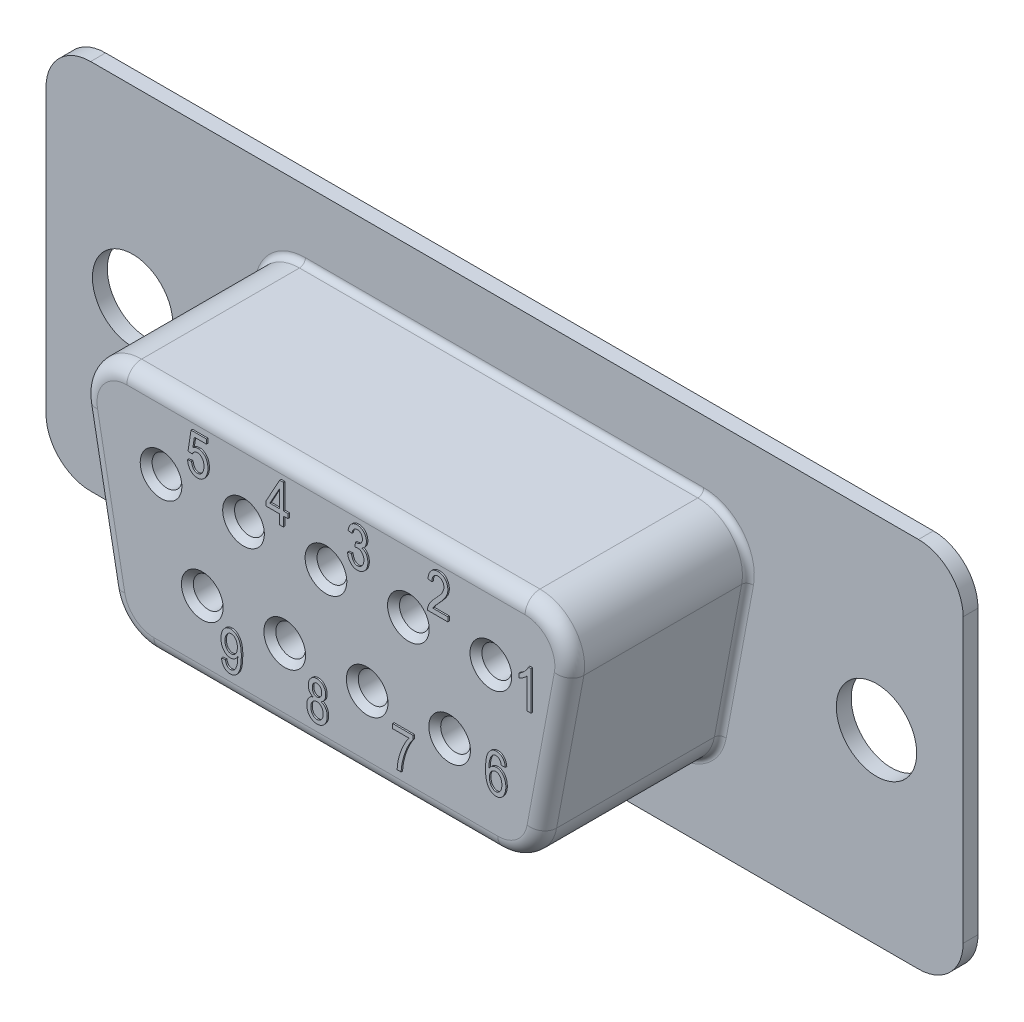
from build123d import *

# Parameters (mm, degrees)
RESSALTO_EXTRUS_O1_DEPTH            = 0.5
ESBO_O3_R                           = 1.35
CORTE_EXTRUS_O1_DEPTH               = 17.632093224
RESSALTO_EXTRUS_O2_DEPTH            = 6
ESBO_O5_R                           = 0.5
CORTE_EXTRUS_O2_DEPTH               = 18.850112745
CHANFRO1_SIZE                       = 0.2
PADR_O_LINEAR1_COUNT                = 3
PADR_O_LINEAR1_PITCH                = 2.77
CHANFRO1_OF_PADR_O_LINEAR1_SIZE     = 0.2
PADR_O_LINEAR1_COL_COUNT            = 3
PADR_O_LINEAR1_COL_PITCH            = 2.77
CHANFRO1_OF_PADR_O_LINEAR1_COL_SIZE = 0.2
ESBO_O6_R                           = 0.5
CORTE_EXTRUS_O3_DEPTH               = 18.850112745
CHANFRO2_SIZE                       = 0.2
PADR_O_LINEAR2_COUNT                = 3
PADR_O_LINEAR2_PITCH                = 2.77
CHANFRO2_OF_PADR_O_LINEAR2_SIZE     = 0.2
PADR_O_LINEAR2_COL_COUNT            = 2
PADR_O_LINEAR2_COL_PITCH            = 2.77
CHANFRO2_OF_PADR_O_LINEAR2_COL_SIZE = 0.2
FILETE1_R                           = 0.5
FILETE2_R                           = 0.2
RESSALTO_EXTRUS_O3_DEPTH            = 0.05
RESSALTO_EXTRUS_O4_START            = -5
ESBO_O8_R                           = 0.5
ESBO_O8_R_2                         = 0.45
RESSALTO_EXTRUS_O4_DEPTH            = 5
PADR_O_LINEAR3_COUNT                = 5
PADR_O_LINEAR3_PITCH                = 2.77
RESSALTO_EXTRUS_O5_START            = -5
ESBO_O9_R                           = 0.5
ESBO_O9_R_2                         = 0.45
RESSALTO_EXTRUS_O5_DEPTH            = 5
PADR_O_LINEAR4_COUNT                = 4
PADR_O_LINEAR4_PITCH                = 2.77


with BuildPart() as part:
    # Esboço2 → Ressalto-extrusão1 (new body)
    with BuildSketch(Plane.XY):
        with BuildLine():
            Line((-13.905, 6.25), (13.905, 6.25))
            ThreePointArc((13.905, 6.25), (14.965660172, 5.810660172), (15.405, 4.75))
            Line((15.405, 4.75), (15.405, -4.75))
            ThreePointArc((15.405, -4.75), (14.965660172, -5.810660172), (13.905, -6.25))
            Line((13.905, -6.25), (-13.905, -6.25))
            ThreePointArc((-13.905, -6.25), (-14.965660172, -5.810660172), (-15.405, -4.75))
            Line((-15.405, -4.75), (-15.405, 4.75))
            ThreePointArc((-15.405, 4.75), (-14.965660172, 5.810660172), (-13.905, 6.25))
        make_face()
    extrude(amount=RESSALTO_EXTRUS_O1_DEPTH)

    # Esboço3 → Corte-extrusão1 (cut, through all)
    with BuildSketch(Plane.XY.offset(0.5)):
        with Locations((12.495, 0)):
            Circle(ESBO_O3_R)
    corte_extrus_o1 = extrude(amount=-CORTE_EXTRUS_O1_DEPTH, mode=Mode.SUBTRACT)

    # Espelhar1: Corte-extrusão1 across plane
    add(corte_extrus_o1.mirror(Plane(origin=(0, 0, 0), x_dir=(0, 0, 1), z_dir=(1, 0, 0))), mode=Mode.SUBTRACT)

    # Esboço4 → Ressalto-extrusão2 (add)
    with BuildSketch(Plane.XY.offset(0.5)):
        with BuildLine():
            Line((-6.690487724, 3.95), (6.690487724, 3.95))
            ThreePointArc((6.690487724, 3.95), (7.844397143, 3.408380431), (8.165, 2.174657401))
            Line((8.165, 2.174657401), (7.25, -2.725342599))
            ThreePointArc((7.25, -2.725342599), (6.733868155, -3.60390942), (5.775487724, -3.95))
            Line((5.775487724, -3.95), (-5.775487724, -3.95))
            ThreePointArc((-5.775487724, -3.95), (-6.733868155, -3.60390942), (-7.25, -2.725342599))
            Line((-7.25, -2.725342599), (-8.165, 2.174657401))
            ThreePointArc((-8.165, 2.174657401), (-7.844397143, 3.408380431), (-6.690487724, 3.95))
        make_face()
    extrude(amount=RESSALTO_EXTRUS_O2_DEPTH)

    # Esboço5 → Corte-extrusão2 (cut, through all)
    with BuildSketch(Plane.XY.offset(6.5)):
        with Locations((0, 1.42)):
            Circle(ESBO_O5_R)
    corte_extrus_o2 = extrude(amount=-CORTE_EXTRUS_O2_DEPTH, mode=Mode.SUBTRACT)

    # Chanfro1
    chanfro1_edges = [part.edges().sort_by_distance(p)[0] for p in [
        (-0.5, 1.42, 6.5),
    ]]
    chamfer(chanfro1_edges, length=CHANFRO1_SIZE)

    # Padrão linear1: Corte-extrusão2 ×3
    with Locations(*[(i * PADR_O_LINEAR1_PITCH, 0, 0) for i in range(1, PADR_O_LINEAR1_COUNT)]):
        add(corte_extrus_o2, mode=Mode.SUBTRACT)

    # Chanfro1 of Padrão linear1
    chanfro1_of_padr_o_linear1_edges = [part.edges().sort_by_distance(p)[0] for p in [
        (2.27, 1.42, 6.5),
        (5.04, 1.42, 6.5),
    ]]
    chamfer(chanfro1_of_padr_o_linear1_edges, length=CHANFRO1_OF_PADR_O_LINEAR1_SIZE)

    # Padrão linear1 col: Corte-extrusão2 ×3
    with Locations(*[(-i * PADR_O_LINEAR1_COL_PITCH, 0, 0) for i in range(1, PADR_O_LINEAR1_COL_COUNT)]):
        add(corte_extrus_o2, mode=Mode.SUBTRACT)

    # Chanfro1 of Padrão linear1 col
    chanfro1_of_padr_o_linear1_col_edges = [part.edges().sort_by_distance(p)[0] for p in [
        (-3.27, 1.42, 6.5),
        (-6.04, 1.42, 6.5),
    ]]
    chamfer(chanfro1_of_padr_o_linear1_col_edges, length=CHANFRO1_OF_PADR_O_LINEAR1_COL_SIZE)

    # Esboço6 → Corte-extrusão3 (cut, through all)
    with BuildSketch(Plane.XY.offset(6.5)):
        with Locations((-1.385, -1.42)):
            Circle(ESBO_O6_R)
    corte_extrus_o3 = extrude(amount=-CORTE_EXTRUS_O3_DEPTH, mode=Mode.SUBTRACT)

    # Chanfro2
    chanfro2_edges = [part.edges().sort_by_distance(p)[0] for p in [
        (-1.885, -1.42, 6.5),
    ]]
    chamfer(chanfro2_edges, length=CHANFRO2_SIZE)

    # Padrão linear2: Corte-extrusão3 ×3
    with Locations(*[(i * PADR_O_LINEAR2_PITCH, 0, 0) for i in range(1, PADR_O_LINEAR2_COUNT)]):
        add(corte_extrus_o3, mode=Mode.SUBTRACT)

    # Chanfro2 of Padrão linear2
    chanfro2_of_padr_o_linear2_edges = [part.edges().sort_by_distance(p)[0] for p in [
        (0.885, -1.42, 6.5),
        (3.655, -1.42, 6.5),
    ]]
    chamfer(chanfro2_of_padr_o_linear2_edges, length=CHANFRO2_OF_PADR_O_LINEAR2_SIZE)

    # Padrão linear2 col: Corte-extrusão3 ×2
    with Locations(*[(-i * PADR_O_LINEAR2_COL_PITCH, 0, 0) for i in range(1, PADR_O_LINEAR2_COL_COUNT)]):
        add(corte_extrus_o3, mode=Mode.SUBTRACT)

    # Chanfro2 of Padrão linear2 col
    chanfro2_of_padr_o_linear2_col_edges = [part.edges().sort_by_distance(p)[0] for p in [
        (-4.655, -1.42, 6.5),
    ]]
    chamfer(chanfro2_of_padr_o_linear2_col_edges, length=CHANFRO2_OF_PADR_O_LINEAR2_COL_SIZE)

    # Filete1
    filete1_edges = [part.edges().sort_by_distance(p)[0] for p in [
        (-7.844397143, 3.408380431, 6.5),
        (-7.7075, -0.275342599, 6.5),
        (-6.733868155, -3.60390942, 6.5),
        (0, -3.95, 6.5),
        (6.733868155, -3.60390942, 6.5),
        (7.7075, -0.275342599, 6.5),
        (7.844397143, 3.408380431, 6.5),
        (0, 3.95, 6.5),
    ]]
    fillet(filete1_edges, radius=FILETE1_R)

    # Filete2
    filete2_edges = [part.edges().sort_by_distance(p)[0] for p in [
        (-7.844397143, 3.408380431, 0.5),
        (-7.7075, -0.275342599, 0.5),
        (-6.733868155, -3.60390942, 0.5),
        (0, -3.95, 0.5),
        (6.733868155, -3.60390942, 0.5),
        (7.7075, -0.275342599, 0.5),
        (7.844397143, 3.408380431, 0.5),
        (0, 3.95, 0.5),
    ]]
    fillet(filete2_edges, radius=FILETE2_R)

    # Esboço7 → Ressalto-extrusão3 (add)
    # profile 1 of 9: a face of its own
    with BuildSketch(Plane.XY.offset(6.5)):
        with BuildLine():
            Line((6.938677294, 0.736527866), (6.805258142, 0.736527866))
            Line((6.805258142, 0.736527866), (6.805258142, 1.753848904))
            add(Edge.make_bspline(
                [(6.805258142, 1.753848904), (6.797064384, 1.744417187), (6.780082831, 1.724869962), (6.750603725, 1.697071085), (6.717752518, 1.668404771), (6.681381871, 1.64058832), (6.644323076, 1.61394466), (6.607720629, 1.590511099), (6.572946374, 1.570122133), (6.549617757, 1.559039788), (6.538419837, 1.553720175)],
                knots=[0, 0, 0, 0, 0.892555828, 1.849821039, 2.893015883, 4.008277588, 5.121255548, 6.154629642, 7.114207698, 8, 8, 8, 8], degree=3))
            Line((6.538419837, 1.553720175), (6.538419837, 1.703816722))
            add(Edge.make_bspline(
                [(6.538419837, 1.703816722), (6.556415797, 1.714647376), (6.592253624, 1.736215944), (6.642467109, 1.773579669), (6.68990314, 1.813907667), (6.733143865, 1.857622485), (6.771861185, 1.902685919), (6.805093151, 1.947659281), (6.832341258, 1.992064737), (6.845707326, 2.022610567), (6.852163312, 2.037364603)],
                knots=[0, 0, 0, 0, 1.082272232, 2.155277244, 3.222407096, 4.289527553, 5.32168536, 6.282742408, 7.170542132, 8, 8, 8, 8], degree=3))
            Line((6.852163312, 2.037364603), (6.938677294, 2.037364603))
            Line((6.938677294, 2.037364603), (6.938677294, 0.736527866))
        make_face()
    # profile 2 of 9: a face of its own
    with BuildSketch(Plane.XY.offset(6.5)):
        with BuildLine():
            Line((-4.599397663, 2.345046989), (-4.465978511, 2.361724383))
            add(Edge.make_bspline(
                [(-4.465978511, 2.361724383), (-4.464624309, 2.351540908), (-4.461985206, 2.331695082), (-4.456107995, 2.303126078), (-4.449625478, 2.276356425), (-4.440970092, 2.251912016), (-4.432189377, 2.229007247), (-4.42133457, 2.208485286), (-4.409716077, 2.189739273), (-4.396513857, 2.17337997), (-4.382803581, 2.158660149), (-4.368199024, 2.1462059), (-4.353082481, 2.135600043), (-4.337549249, 2.126680761), (-4.321275291, 2.119826548), (-4.304444561, 2.115187268), (-4.287149309, 2.11220043), (-4.275416708, 2.111777053), (-4.269497962, 2.111563472)],
                knots=[0, 0, 0, 0, 1.411223046, 2.750228965, 4.006672634, 5.191927097, 6.311278306, 7.373684419, 8.377051755, 9.337097037, 10.257438676, 11.13782359, 11.969011532, 12.792190119, 13.594685164, 14.388253401, 15.186922146, 16, 16, 16, 16], degree=3))
            add(Edge.make_bspline(
                [(-4.269497962, 2.111563472), (-4.262096201, 2.111805465), (-4.247447958, 2.112284373), (-4.225921591, 2.116369531), (-4.205093381, 2.122817762), (-4.185283744, 2.132423484), (-4.166084997, 2.144193436), (-4.147680751, 2.158666069), (-4.130359039, 2.176001237), (-4.11366847, 2.195502661), (-4.098225284, 2.21720759), (-4.085326348, 2.241431486), (-4.074110169, 2.26731906), (-4.064576786, 2.295046103), (-4.057690079, 2.324847355), (-4.052854279, 2.356475897), (-4.049576802, 2.389973208), (-4.049224699, 2.41296445), (-4.04904366, 2.42478578)],
                knots=[0, 0, 0, 0, 0.833557162, 1.649627401, 2.46080936, 3.284070299, 4.12358479, 4.995082037, 5.915776015, 6.88098611, 7.885890802, 8.910954604, 9.967600199, 11.063514457, 12.210406555, 13.409466691, 14.668034258, 16, 16, 16, 16], degree=3))
            add(Edge.make_bspline(
                [(-4.04904366, 2.42478578), (-4.049250164, 2.435824021), (-4.049652511, 2.457330635), (-4.052587811, 2.488663661), (-4.057120229, 2.518141087), (-4.063872724, 2.545721246), (-4.072871161, 2.571247676), (-4.083104825, 2.595157916), (-4.095744297, 2.616995597), (-4.110368223, 2.636649254), (-4.126103416, 2.654431666), (-4.143282661, 2.669657238), (-4.16123582, 2.682696053), (-4.180146346, 2.693707032), (-4.200371771, 2.701545146), (-4.221319384, 2.70780144), (-4.243424628, 2.71108247), (-4.258457522, 2.71165712), (-4.266110367, 2.711949659)],
                knots=[0, 0, 0, 0, 1.312040837, 2.556345105, 3.737883698, 4.854849349, 5.925960309, 6.952388988, 7.9424386, 8.917239489, 9.860521384, 10.760061641, 11.639947922, 12.495504232, 13.352616949, 14.212152034, 15.089854369, 16, 16, 16, 16], degree=3))
            add(Edge.make_bspline(
                [(-4.266110367, 2.711949659), (-4.275351377, 2.711547954), (-4.293786255, 2.710746596), (-4.321009261, 2.704252522), (-4.347155414, 2.693381957), (-4.372166661, 2.67878422), (-4.3954362, 2.660565376), (-4.416127623, 2.638578091), (-4.434577904, 2.613517789), (-4.444329847, 2.594831467), (-4.449301117, 2.585305697)],
                knots=[0, 0, 0, 0, 0.943378558, 1.881944462, 2.841095037, 3.827409543, 4.832274565, 5.849176661, 6.903569879, 8, 8, 8, 8], degree=3))
            Line((-4.449301117, 2.585305697), (-4.582720269, 2.60432835))
            Line((-4.582720269, 2.60432835), (-4.482655905, 3.262303662))
            Line((-4.482655905, 3.262303662), (-3.965656689, 3.262303662))
            Line((-3.965656689, 3.262303662), (-3.965656689, 3.112207116))
            Line((-3.965656689, 3.112207116), (-4.370865248, 3.112207116))
            Line((-4.370865248, 3.112207116), (-4.41907334, 2.795076045))
            add(Edge.make_bspline(
                [(-4.41907334, 2.795076045), (-4.404043348, 2.802762508), (-4.374297774, 2.817974643), (-4.326968558, 2.833817079), (-4.278328857, 2.843593372), (-4.245396127, 2.844775014), (-4.228846814, 2.845368811)],
                knots=[0, 0, 0, 0, 1.017619267, 2.013951072, 3.001973272, 4, 4, 4, 4], degree=3))
            add(Edge.make_bspline(
                [(-4.228846814, 2.845368811), (-4.21848836, 2.845003556), (-4.197901291, 2.844277623), (-4.167638716, 2.838913791), (-4.138371929, 2.830327715), (-4.110237385, 2.817871236), (-4.083220341, 2.801930671), (-4.057118625, 2.782629977), (-4.032058573, 2.759933608), (-4.008574325, 2.733615569), (-3.986684963, 2.704663123), (-3.96757433, 2.67287478), (-3.95135498, 2.638679983), (-3.938484831, 2.601915229), (-3.927883028, 2.562951411), (-3.920723259, 2.521424165), (-3.916606837, 2.477507676), (-3.915957173, 2.447465504), (-3.915624507, 2.43208214)],
                knots=[0, 0, 0, 0, 0.861018809, 1.711245113, 2.547675859, 3.391805506, 4.262674834, 5.151129072, 6.086914488, 7.068866089, 8.080081396, 9.100796714, 10.1476286, 11.221399762, 12.335728169, 13.501851446, 14.720800604, 16, 16, 16, 16], degree=3))
            add(Edge.make_bspline(
                [(-3.915624507, 2.43208214), (-3.915941703, 2.416784694), (-3.916566631, 2.386646234), (-3.920998352, 2.342295284), (-3.928604776, 2.299636242), (-3.939039236, 2.258609576), (-3.952238919, 2.219141446), (-3.968774979, 2.181409215), (-3.988367974, 2.145450785), (-4.010585049, 2.111403677), (-4.03535252, 2.080332571), (-4.062306362, 2.05280439), (-4.091653745, 2.029835699), (-4.122914767, 2.010803886), (-4.156303566, 1.996105756), (-4.1917695, 1.985700529), (-4.229308484, 1.979272591), (-4.255052896, 1.978525632), (-4.268195041, 1.97814432)],
                knots=[0, 0, 0, 0, 1.144340564, 2.254537473, 3.330370625, 4.383172833, 5.418849903, 6.440219285, 7.460844228, 8.47914966, 9.47775429, 10.428908251, 11.354479858, 12.258284926, 13.160219244, 14.07516849, 15.0174017, 16, 16, 16, 16], degree=3))
            add(Edge.make_bspline(
                [(-4.268195041, 1.97814432), (-4.279153962, 1.978458156), (-4.300728257, 1.979075989), (-4.332442741, 1.983562612), (-4.362847645, 1.991121362), (-4.39196227, 2.001848836), (-4.419657457, 2.015803366), (-4.446197576, 2.032532718), (-4.471206063, 2.052516613), (-4.49497137, 2.075157792), (-4.516808253, 2.100581325), (-4.536124273, 2.128702732), (-4.553149541, 2.159009838), (-4.567498207, 2.191753048), (-4.579116762, 2.22678461), (-4.588514298, 2.264055175), (-4.595657498, 2.30366454), (-4.598131346, 2.33103603), (-4.599397663, 2.345046989)],
                knots=[0, 0, 0, 0, 0.958587677, 1.88712499, 2.795765124, 3.694982091, 4.595578744, 5.504218877, 6.434682167, 7.391400486, 8.372260331, 9.360890354, 10.371359061, 11.409147611, 12.483330096, 13.596558593, 14.769722824, 16, 16, 16, 16], degree=3))
        make_face()
    # profile 3 of 9: a face of its own
    with BuildSketch(Plane.XY.offset(6.5)):
        Polygon((-1.512412023, 1.994821714), (-1.512412023, 2.311692201), (-1.962701663, 2.311692201), (-1.962701663, 2.461788748), (-1.504855079, 3.295658451), (-1.378992871, 3.295658451), (-1.378992871, 2.461788748), (-1.228896324, 2.461788748), (-1.228896324, 2.311692201), (-1.378992871, 2.311692201), (-1.378992871, 1.994821714), align=None)
        Polygon((-1.512412023, 2.461788748), (-1.512412023, 3.042109944), (-1.8311066, 2.461788748), align=None, mode=Mode.SUBTRACT)
    # profile 4 of 9: a face of its own
    with BuildSketch(Plane.XY.offset(6.5)):
        with BuildLine():
            Line((0.774058702, 2.345046989), (0.907477854, 2.361724383))
            add(Edge.make_bspline(
                [(0.907477854, 2.361724383), (0.909198596, 2.351628042), (0.912551693, 2.331953969), (0.9191491, 2.30364214), (0.926349548, 2.277149626), (0.934695026, 2.252725828), (0.943791841, 2.230132181), (0.953879596, 2.209512746), (0.965158079, 2.190870977), (0.977349675, 2.174196066), (0.99049204, 2.159409052), (1.004525392, 2.146606792), (1.019581156, 2.135798445), (1.035515814, 2.126803596), (1.052581527, 2.120130839), (1.070442985, 2.115038197), (1.089362628, 2.112205754), (1.102299211, 2.111780677), (1.108909505, 2.111563472)],
                knots=[0, 0, 0, 0, 1.392235382, 2.712957193, 3.95076201, 5.123471921, 6.220028287, 7.260520794, 8.240826993, 9.178593426, 10.065213643, 10.926376853, 11.755607984, 12.580369742, 13.407158359, 14.241002189, 15.101193065, 16, 16, 16, 16], degree=3))
            add(Edge.make_bspline(
                [(1.108909505, 2.111563472), (1.116139472, 2.111701038), (1.130350097, 2.111971426), (1.151174798, 2.115999513), (1.171407144, 2.121498765), (1.190698265, 2.130064056), (1.209387855, 2.140588625), (1.227499321, 2.153286316), (1.244320922, 2.168983753), (1.260701946, 2.186239308), (1.275810381, 2.205395579), (1.28883742, 2.226318441), (1.299808744, 2.248701226), (1.309015197, 2.27227624), (1.315603479, 2.297426686), (1.321030669, 2.323651336), (1.323753038, 2.351504531), (1.324189158, 2.370492806), (1.324412706, 2.380225867)],
                knots=[0, 0, 0, 0, 0.904038564, 1.776903143, 2.648138989, 3.525264603, 4.411852617, 5.332561374, 6.2875971, 7.288147468, 8.311042921, 9.337403868, 10.368883854, 11.429611823, 12.501164111, 13.621320171, 14.780729868, 16, 16, 16, 16], degree=3))
            add(Edge.make_bspline(
                [(1.324412706, 2.380225867), (1.324176401, 2.389351747), (1.323716323, 2.407119542), (1.321185825, 2.433108954), (1.316549346, 2.457731376), (1.30962176, 2.480919553), (1.301418204, 2.503030666), (1.290947025, 2.523613279), (1.278590407, 2.542785195), (1.264610869, 2.560410343), (1.249176738, 2.576294768), (1.23289955, 2.590433238), (1.21551539, 2.602182753), (1.197462317, 2.612076058), (1.178248017, 2.619187463), (1.158432418, 2.624847956), (1.137586075, 2.627974289), (1.123424984, 2.628364013), (1.116205864, 2.628562688)],
                knots=[0, 0, 0, 0, 1.208507307, 2.352925112, 3.453685551, 4.520081629, 5.553915499, 6.572344605, 7.570902253, 8.569592363, 9.545641393, 10.499968035, 11.418701314, 12.319183888, 13.218416966, 14.125267075, 15.044288268, 16, 16, 16, 16], degree=3))
            add(Edge.make_bspline(
                [(1.116205864, 2.628562688), (1.109677921, 2.628357245), (1.095762141, 2.627919296), (1.073849766, 2.624131878), (1.049599603, 2.618808703), (1.032956569, 2.613585132), (1.024219613, 2.610842957)],
                knots=[0, 0, 0, 0, 0.832645691, 1.774971563, 2.831945141, 4, 4, 4, 4], degree=3))
            Line((1.024219613, 2.610842957), (1.040897007, 2.761981841))
            Line((1.040897007, 2.761981841), (1.060961997, 2.760157751))
            add(Edge.make_bspline(
                [(1.060961997, 2.760157751), (1.068705006, 2.760245565), (1.083814236, 2.76041692), (1.105911772, 2.76358348), (1.126991092, 2.767778739), (1.146838927, 2.774145838), (1.165696536, 2.781972731), (1.183270119, 2.791893556), (1.199880282, 2.803461533), (1.215230024, 2.81667722), (1.229009632, 2.831618113), (1.241319041, 2.847657419), (1.251493819, 2.865045826), (1.259948633, 2.883443274), (1.266431523, 2.90311566), (1.271162673, 2.92395963), (1.273677396, 2.946067207), (1.274142137, 2.961149415), (1.274380524, 2.968885761)],
                knots=[0, 0, 0, 0, 1.104467345, 2.155189185, 3.181695374, 4.170183668, 5.126157628, 6.092295424, 7.04536858, 8.012620263, 8.977961638, 9.942904556, 10.893715412, 11.848320646, 12.828840281, 13.845861792, 14.895045293, 16, 16, 16, 16], degree=3))
            add(Edge.make_bspline(
                [(1.274380524, 2.968885761), (1.273782541, 2.982743645), (1.272633324, 3.009376019), (1.263811774, 3.047308283), (1.248439823, 3.080884249), (1.227278381, 3.109590895), (1.201813304, 3.13272388), (1.173365796, 3.150059564), (1.14181664, 3.160330995), (1.119840841, 3.161595372), (1.10864892, 3.162239298)],
                knots=[0, 0, 0, 0, 1.168747258, 2.246123166, 3.262822778, 4.26410748, 5.234436762, 6.148309006, 7.056963545, 8, 8, 8, 8], degree=3))
            add(Edge.make_bspline(
                [(1.10864892, 3.162239298), (1.097019502, 3.161698581), (1.074396254, 3.160646698), (1.042046472, 3.150612184), (1.012284288, 3.135240455), (0.990588871, 3.116752142), (0.975214527, 3.099247652), (0.964366775, 3.084497262), (0.9547276, 3.068094993), (0.94655833, 3.049894387), (0.938695856, 3.030397897), (0.933135414, 3.008940398), (0.927581452, 2.986175845), (0.925321494, 2.970302145), (0.924155248, 2.962110569)],
                knots=[0, 0, 0, 0, 1.389180941, 2.702438466, 4.019316734, 5.377896697, 6.085434137, 6.807430375, 7.567469407, 8.358691296, 9.195188439, 10.081130764, 11.009773198, 12, 12, 12, 12], degree=3))
            Line((0.924155248, 2.962110569), (0.790736096, 2.978787963))
            add(Edge.make_bspline(
                [(0.790736096, 2.978787963), (0.792920747, 2.991502195), (0.797182348, 3.016303864), (0.80608583, 3.051992099), (0.816682153, 3.085332282), (0.829511759, 3.116140823), (0.844079199, 3.144685184), (0.860560902, 3.170844902), (0.878742196, 3.194791724), (0.899254723, 3.215864238), (0.921056084, 3.234632464), (0.944158943, 3.250841051), (0.968151391, 3.264792316), (0.99342888, 3.276031695), (1.019754059, 3.284943999), (1.047258738, 3.291180761), (1.075801592, 3.294867723), (1.095174588, 3.295392353), (1.10500074, 3.295658451)],
                knots=[0, 0, 0, 0, 1.259750421, 2.457396855, 3.589696629, 4.673763457, 5.713494597, 6.716289503, 7.690389722, 8.644478697, 9.583164327, 10.496506905, 11.397350125, 12.289843847, 13.194037124, 14.107891875, 15.040306322, 16, 16, 16, 16], degree=3))
            add(Edge.make_bspline(
                [(1.10500074, 3.295658451), (1.115354309, 3.295353044), (1.135723376, 3.294752204), (1.165661637, 3.290142006), (1.19445408, 3.282956238), (1.222024052, 3.27247983), (1.248126496, 3.258679871), (1.27340437, 3.242497642), (1.297431458, 3.223109406), (1.319831193, 3.200831924), (1.340392146, 3.17645408), (1.358426302, 3.150261423), (1.373916022, 3.122696142), (1.386215932, 3.093358924), (1.395830003, 3.062545943), (1.40285538, 3.030207089), (1.407157287, 2.99627675), (1.407582297, 2.973154919), (1.407799676, 2.961328817)],
                knots=[0, 0, 0, 0, 0.987546189, 1.94284647, 2.883618689, 3.814886987, 4.749064414, 5.696240478, 6.674807358, 7.688712876, 8.706405422, 9.713376545, 10.718845743, 11.717906576, 12.742863162, 13.794678478, 14.872046121, 16, 16, 16, 16], degree=3))
            add(Edge.make_bspline(
                [(1.407799676, 2.961328817), (1.407398266, 2.947049282), (1.406614319, 2.919161561), (1.399057887, 2.878708069), (1.387065851, 2.84075578), (1.37033992, 2.805557133), (1.349497462, 2.773292965), (1.324463066, 2.744753437), (1.29589218, 2.719456213), (1.274168136, 2.706166456), (1.2631754, 2.699441613)],
                knots=[0, 0, 0, 0, 1.090109576, 2.128968013, 3.132278696, 4.123864162, 5.09769889, 6.057339906, 7.016980922, 8, 8, 8, 8], degree=3))
            add(Edge.make_bspline(
                [(1.2631754, 2.699441613), (1.273272945, 2.696334704), (1.293002268, 2.690264198), (1.320220358, 2.676593726), (1.345038614, 2.660718061), (1.367214178, 2.641675869), (1.386937159, 2.619460704), (1.404548501, 2.593918313), (1.419679838, 2.564804577), (1.433350233, 2.53284513), (1.444063306, 2.498062732), (1.452294082, 2.461152794), (1.456961448, 2.422126444), (1.457537328, 2.395438678), (1.457831858, 2.381789373)],
                knots=[0, 0, 0, 0, 0.945190562, 1.846782401, 2.71900073, 3.580139159, 4.456653473, 5.37426406, 6.352713278, 7.392141409, 8.485180558, 9.608884637, 10.777077804, 12, 12, 12, 12], degree=3))
            add(Edge.make_bspline(
                [(1.457831858, 2.381789373), (1.457576306, 2.367267045), (1.457077387, 2.338914967), (1.451859866, 2.297359426), (1.443963484, 2.25783471), (1.432699429, 2.220199536), (1.41814372, 2.18474507), (1.40016842, 2.151268555), (1.379152585, 2.119766526), (1.354956253, 2.090680809), (1.328498991, 2.064638916), (1.30077481, 2.041367006), (1.271574385, 2.02184374), (1.241146421, 2.005714922), (1.209354823, 1.993467387), (1.176369715, 1.984516337), (1.142000261, 1.979229569), (1.118656027, 1.978509342), (1.10682483, 1.97814432)],
                knots=[0, 0, 0, 0, 1.16797173, 2.280242353, 3.364490462, 4.408173669, 5.436152277, 6.443028727, 7.460738993, 8.478233232, 9.481512989, 10.444418881, 11.386528098, 12.302557467, 13.209825675, 14.12198051, 15.04819242, 16, 16, 16, 16], degree=3))
            add(Edge.make_bspline(
                [(1.10682483, 1.97814432), (1.095862728, 1.978433786), (1.074269731, 1.979003971), (1.042567404, 1.983846713), (1.012147343, 1.991618961), (0.983123954, 2.002704034), (0.955158227, 2.016566085), (0.928683592, 2.033826402), (0.903370507, 2.05415858), (0.879585169, 2.077423685), (0.857850023, 2.103466758), (0.838108292, 2.131543659), (0.820768084, 2.161802536), (0.806653146, 2.194539591), (0.794574021, 2.229099988), (0.784913621, 2.265759183), (0.777829239, 2.304620318), (0.775333008, 2.331384231), (0.774058702, 2.345046989)],
                knots=[0, 0, 0, 0, 0.959274814, 1.889566238, 2.800731978, 3.703256649, 4.604498869, 5.528396462, 6.464265966, 7.442996794, 8.436156864, 9.429840861, 10.444772988, 11.483305447, 12.546329121, 13.647537524, 14.799087218, 16, 16, 16, 16], degree=3))
        make_face()
    # profile 5 of 9: a face of its own
    with BuildSketch(Plane.XY.offset(6.5)):
        with BuildLine():
            Line((4.144560041, 2.144918261), (4.144560041, 1.994821714))
            Line((4.144560041, 1.994821714), (3.460786885, 1.994821714))
            add(Edge.make_bspline(
                [(3.460786885, 1.994821714), (3.460755226, 2.002642372), (3.460691084, 2.018487153), (3.4628236, 2.04264392), (3.467205039, 2.067385537), (3.47279969, 2.09304206), (3.480732294, 2.119276051), (3.490443274, 2.146214979), (3.501901375, 2.173791778), (3.515317767, 2.202169767), (3.530995495, 2.231621151), (3.54991397, 2.262022712), (3.571655989, 2.293919784), (3.596250305, 2.327117915), (3.624177926, 2.361302258), (3.654609929, 2.396980276), (3.687980621, 2.434077658), (3.711740625, 2.458732923), (3.72397701, 2.471430366)],
                knots=[0, 0, 0, 0, 0.672188691, 1.361865275, 2.08134618, 2.831455259, 3.618325166, 4.435686407, 5.292818481, 6.184803937, 7.133719261, 8.159707436, 9.261705982, 10.452168352, 11.710682541, 13.056179633, 14.483934645, 16, 16, 16, 16], degree=3))
            add(Edge.make_bspline(
                [(3.72397701, 2.471430366), (3.73819706, 2.486138575), (3.765576662, 2.514458087), (3.804110837, 2.556273583), (3.839123004, 2.595140566), (3.869913645, 2.631761868), (3.897029404, 2.665638715), (3.920743097, 2.696722672), (3.939921446, 2.72571917), (3.96062861, 2.759837714), (3.980369949, 2.800455301), (3.997822411, 2.847801524), (4.009098936, 2.893571233), (4.010473488, 2.923746227), (4.011140889, 2.9383974)],
                knots=[0, 0, 0, 0, 1.312560889, 2.527233899, 3.64818266, 4.668586789, 5.596397896, 6.432357998, 7.175835261, 7.825761013, 8.992224112, 10.065918602, 11.060925749, 12, 12, 12, 12], degree=3))
            add(Edge.make_bspline(
                [(4.011140889, 2.9383974), (4.011047829, 2.946486013), (4.010866073, 2.962283921), (4.007777389, 2.985355076), (4.003372519, 3.007299318), (3.997556784, 3.028275242), (3.989310744, 3.047938313), (3.979430597, 3.066424956), (3.967857407, 3.083818898), (3.954650639, 3.099864702), (3.940086579, 3.114340024), (3.924738103, 3.127344281), (3.908205933, 3.137869324), (3.891169545, 3.147031587), (3.873053247, 3.153671835), (3.854238521, 3.15873342), (3.834551293, 3.161587373), (3.821183529, 3.162019835), (3.814399756, 3.162239298)],
                knots=[0, 0, 0, 0, 1.164486654, 2.274364258, 3.346924328, 4.388668322, 5.404300818, 6.412115579, 7.404820287, 8.409522099, 9.400647826, 10.360464378, 11.301161788, 12.219192522, 13.141987859, 14.073903283, 15.022558797, 16, 16, 16, 16], degree=3))
            add(Edge.make_bspline(
                [(3.814399756, 3.162239298), (3.807085517, 3.162085854), (3.792807789, 3.161786325), (3.771997068, 3.158063984), (3.752056576, 3.153084227), (3.733087498, 3.145361058), (3.715228585, 3.13546815), (3.698222569, 3.123560152), (3.682402323, 3.109411978), (3.66744916, 3.093323811), (3.654340808, 3.074978202), (3.642305417, 3.055126247), (3.632828054, 3.032927019), (3.624769561, 3.009065031), (3.618458493, 2.983262132), (3.614240048, 2.955615634), (3.611146454, 2.926132278), (3.610972718, 2.905833152), (3.610883431, 2.895400993)],
                knots=[0, 0, 0, 0, 0.928788257, 1.813037313, 2.680996359, 3.53827917, 4.408273621, 5.272359245, 6.172129225, 7.102295458, 8.058839945, 9.034325244, 10.048074492, 11.120300332, 12.234644845, 13.420320921, 14.674247329, 16, 16, 16, 16], degree=3))
            Line((3.610883431, 2.895400993), (3.477464279, 2.912078387))
            add(Edge.make_bspline(
                [(3.477464279, 2.912078387), (3.478839228, 2.927560619), (3.481506692, 2.957596852), (3.488505376, 3.001078962), (3.498217309, 3.04142257), (3.50974598, 3.079030153), (3.524250376, 3.113434981), (3.540466751, 3.145263184), (3.55968704, 3.173822872), (3.581120833, 3.199467124), (3.604588631, 3.222218804), (3.629958166, 3.241857544), (3.657194989, 3.258412632), (3.685988051, 3.272332791), (3.716932521, 3.282727745), (3.749473254, 3.290272169), (3.783874916, 3.294741847), (3.80735087, 3.295348403), (3.819350857, 3.295658451)],
                knots=[0, 0, 0, 0, 1.296155121, 2.514599762, 3.669097984, 4.755193195, 5.79120272, 6.77953026, 7.729955905, 8.65570694, 9.562583864, 10.450894749, 11.325630111, 12.216772649, 13.112585423, 14.04224033, 14.999270054, 16, 16, 16, 16], degree=3))
            add(Edge.make_bspline(
                [(3.819350857, 3.295658451), (3.83230737, 3.295278126), (3.857535854, 3.294537571), (3.89426258, 3.289657904), (3.928516966, 3.281050501), (3.960452013, 3.269073166), (3.989684191, 3.253305333), (4.016688988, 3.234391388), (4.041015727, 3.211756364), (4.062664304, 3.186000902), (4.081796202, 3.158194788), (4.098490033, 3.129119156), (4.112970592, 3.099255783), (4.124287557, 3.068272375), (4.133738429, 3.036584752), (4.139675672, 3.00371257), (4.143855449, 2.970035116), (4.14432385, 2.947270542), (4.144560041, 2.935791557)],
                knots=[0, 0, 0, 0, 1.141256367, 2.222215694, 3.255808886, 4.246221905, 5.218350639, 6.173592628, 7.142736081, 8.136099926, 9.131465336, 10.11177911, 11.087094076, 12.050634184, 13.014356534, 13.995714735, 14.989343724, 16, 16, 16, 16], degree=3))
            add(Edge.make_bspline(
                [(4.144560041, 2.935791557), (4.144337505, 2.925449494), (4.143895331, 2.904900109), (4.141018957, 2.874239261), (4.135941623, 2.843990624), (4.129348928, 2.813863349), (4.11999385, 2.784323913), (4.109403402, 2.754903158), (4.09655801, 2.72593299), (4.081393705, 2.696847917), (4.063638274, 2.66661869), (4.042361395, 2.63469359), (4.017957649, 2.600219249), (3.989435795, 2.563809922), (3.958177856, 2.524418578), (3.922802912, 2.483037766), (3.884001147, 2.43930258), (3.856664175, 2.409626853), (3.842542858, 2.394297419)],
                knots=[0, 0, 0, 0, 0.78053567, 1.550902233, 2.321464013, 3.094364546, 3.87611052, 4.657966429, 5.453363508, 6.265521698, 7.132350641, 8.097801917, 9.160103787, 10.319208993, 11.587678713, 12.955014444, 14.427067756, 16, 16, 16, 16], degree=3))
            add(Edge.make_bspline(
                [(3.842542858, 2.394297419), (3.833578163, 2.38475942), (3.816445912, 2.366531539), (3.792184591, 2.340155566), (3.770413463, 2.316161673), (3.750658532, 2.294887646), (3.733896435, 2.275618042), (3.719363898, 2.258861891), (3.7074897, 2.244412661), (3.689694004, 2.221697566), (3.667249021, 2.189692203), (3.651742276, 2.159519499), (3.644238219, 2.144918261)],
                knots=[0, 0, 0, 0, 1.227496676, 2.345844757, 3.360613726, 4.265798447, 5.068085109, 5.75545707, 6.345771879, 6.821573405, 8.46188917, 10, 10, 10, 10], degree=3))
            Line((3.644238219, 2.144918261), (4.144560041, 2.144918261))
        make_face()
    # profile 6 of 9: a face of its own
    with BuildSketch(Plane.XY.offset(6.5)):
        with BuildLine():
            Line((-3.459861998, -2.855487264), (-3.326442846, -2.83880987))
            add(Edge.make_bspline(
                [(-3.326442846, -2.83880987), (-3.323774754, -2.854528399), (-3.318727491, -2.884263347), (-3.305884695, -2.925226395), (-3.289935433, -2.96023843), (-3.269995916, -2.989070915), (-3.246134837, -3.011562149), (-3.218543314, -3.027634213), (-3.187313643, -3.037312602), (-3.16529804, -3.038385097), (-3.153936051, -3.038938598)],
                knots=[0, 0, 0, 0, 1.309725382, 2.477624782, 3.519252249, 4.462492528, 5.34180128, 6.193195808, 7.067530017, 8, 8, 8, 8], degree=3))
            add(Edge.make_bspline(
                [(-3.153936051, -3.038938598), (-3.143456543, -3.038382855), (-3.122679896, -3.037281039), (-3.092436371, -3.028537135), (-3.063920807, -3.014350012), (-3.04142489, -2.998461798), (-3.024814478, -2.982248567), (-3.01208576, -2.968234828), (-3.000480178, -2.951497375), (-2.989044532, -2.932941566), (-2.978388249, -2.912025561), (-2.967900924, -2.889246802), (-2.958454193, -2.864053087), (-2.945582525, -2.827416585), (-2.932297277, -2.777646708), (-2.921322907, -2.713803482), (-2.914445931, -2.645345532), (-2.913594893, -2.598133796), (-2.913156174, -2.573795655)],
                knots=[0, 0, 0, 0, 0.871681479, 1.728193698, 2.598433288, 3.51585727, 4.0070026, 4.529633168, 5.089671721, 5.700050678, 6.343889226, 7.043128753, 7.787355008, 8.583454758, 10.276770505, 12.068987891, 13.973522342, 16, 16, 16, 16], degree=3))
            Line((-2.913156174, -2.573795655), (-2.913156174, -2.542264957))
            add(Edge.make_bspline(
                [(-2.913156174, -2.542264957), (-2.920137761, -2.5543739), (-2.93391781, -2.578274173), (-2.959862929, -2.610162931), (-2.988956244, -2.638303838), (-3.021067979, -2.662218694), (-3.055298119, -2.681016364), (-3.090099911, -2.695188704), (-3.125571895, -2.70358975), (-3.149377284, -2.704791996), (-3.161232411, -2.705390717)],
                knots=[0, 0, 0, 0, 1.076943371, 2.125638765, 3.158845653, 4.193572763, 5.204435146, 6.163898621, 7.085618246, 8, 8, 8, 8], degree=3))
            add(Edge.make_bspline(
                [(-3.161232411, -2.705390717), (-3.171766027, -2.705033426), (-3.192615534, -2.704326229), (-3.223286311, -2.698878904), (-3.253069088, -2.690426585), (-3.281405761, -2.677649599), (-3.308876044, -2.661957237), (-3.334938655, -2.642440299), (-3.360109372, -2.619624448), (-3.383852197, -2.59345919), (-3.405867589, -2.564327184), (-3.424822356, -2.532211513), (-3.440808298, -2.49752355), (-3.453733432, -2.46029692), (-3.46426732, -2.420616241), (-3.471462062, -2.37823104), (-3.475560028, -2.333270963), (-3.476207249, -2.302449071), (-3.476539392, -2.286631776)],
                knots=[0, 0, 0, 0, 0.86465958, 1.711446896, 2.551263658, 3.400931007, 4.257488752, 5.144979063, 6.069240711, 7.043889745, 8.042652401, 9.063041585, 10.100422143, 11.174417838, 12.295707709, 13.468554313, 14.700903177, 16, 16, 16, 16], degree=3))
            add(Edge.make_bspline(
                [(-3.476539392, -2.286631776), (-3.476237705, -2.270377049), (-3.475647692, -2.238587499), (-3.471100764, -2.192282012), (-3.464142103, -2.148522184), (-3.45311175, -2.10770276), (-3.440153155, -2.069230911), (-3.423520324, -2.033626936), (-3.404265909, -2.000495119), (-3.381832027, -1.970467346), (-3.357488704, -1.943409899), (-3.331508641, -1.919828988), (-3.304464115, -1.8994976), (-3.275711361, -1.883344143), (-3.245946119, -1.870275862), (-3.214678793, -1.861639653), (-3.182296488, -1.855807161), (-3.160216595, -1.855168497), (-3.148984949, -1.85484362)],
                knots=[0, 0, 0, 0, 1.28857615, 2.520082744, 3.686305779, 4.797202427, 5.868826455, 6.901108228, 7.907493629, 8.90202596, 9.867517396, 10.788992686, 11.680218227, 12.543873392, 13.398473814, 14.25085117, 15.110239307, 16, 16, 16, 16], degree=3))
            add(Edge.make_bspline(
                [(-3.148984949, -1.85484362), (-3.140982578, -1.8550382), (-3.125003829, -1.855426729), (-3.101315518, -1.858740935), (-3.0780095, -1.863603644), (-3.055119761, -1.870683353), (-3.03280322, -1.880149011), (-3.010825115, -1.891472284), (-2.989029406, -1.904415782), (-2.968096199, -1.919883484), (-2.947649608, -1.937038116), (-2.928403954, -1.956328829), (-2.910440759, -1.977612366), (-2.893292923, -2.000465837), (-2.878153955, -2.025788469), (-2.86334591, -2.052560169), (-2.850201172, -2.08154278), (-2.838059148, -2.112551495), (-2.82729603, -2.146302174), (-2.817958957, -2.183279094), (-2.81030825, -2.22376996), (-2.80371482, -2.26765245), (-2.798966122, -2.315058219), (-2.795247749, -2.365972664), (-2.793263112, -2.420382644), (-2.792935124, -2.457834258), (-2.792766236, -2.477118886)],
                knots=[0, 0, 0, 0, 0.71982096, 1.437303798, 2.148671553, 2.860726122, 3.5894893, 4.327127712, 5.084546776, 5.867862187, 6.666549548, 7.484587174, 8.316328227, 9.17150421, 10.052303838, 10.968733071, 11.923593905, 12.913579202, 13.964198915, 15.109293659, 16.343376022, 17.671051532, 19.10143247, 20.629623286, 22.264521701, 24, 24, 24, 24], degree=3))
            add(Edge.make_bspline(
                [(-2.792766236, -2.477118886), (-2.792908304, -2.498662595), (-2.793183939, -2.540460579), (-2.795537531, -2.601378713), (-2.799474327, -2.658546989), (-2.804479601, -2.712125003), (-2.81147798, -2.761858751), (-2.820187048, -2.807897571), (-2.829756362, -2.850386209), (-2.841639089, -2.889207828), (-2.854894118, -2.924803838), (-2.868482842, -2.958031271), (-2.883664563, -2.988666423), (-2.900068635, -3.016705192), (-2.917279767, -3.042534582), (-2.935752024, -3.065731648), (-2.955401505, -3.086448354), (-2.976003464, -3.104731641), (-2.997509672, -3.120676151), (-3.019583419, -3.134577641), (-3.042476187, -3.145954656), (-3.065672799, -3.155878718), (-3.089864584, -3.162993968), (-3.114545821, -3.168618516), (-3.139957703, -3.171745175), (-3.15705529, -3.172152633), (-3.165662343, -3.172357751)],
                knots=[0, 0, 0, 0, 1.764807986, 3.42398863, 4.99306403, 6.458696006, 7.831295522, 9.105472131, 10.296422921, 11.39714146, 12.428197542, 13.407419317, 14.336630445, 15.226313195, 16.067043525, 16.877164758, 17.652279824, 18.403342349, 19.130566392, 19.843339087, 20.537068434, 21.222906937, 21.90719335, 22.599498013, 23.294976811, 24, 24, 24, 24], degree=3))
            add(Edge.make_bspline(
                [(-3.165662343, -3.172357751), (-3.175406429, -3.172126566), (-3.19454127, -3.171672578), (-3.22260082, -3.167521792), (-3.249466549, -3.161480098), (-3.275032742, -3.152451754), (-3.299391809, -3.140924297), (-3.322556478, -3.126891055), (-3.344397034, -3.110214025), (-3.36503204, -3.09122707), (-3.383955903, -3.069634818), (-3.401034775, -3.045751844), (-3.415925501, -3.019538021), (-3.428593195, -2.991008216), (-3.439556621, -2.960348701), (-3.448763368, -2.92747815), (-3.455394797, -2.892223566), (-3.458349246, -2.867927472), (-3.459861998, -2.855487264)],
                knots=[0, 0, 0, 0, 0.974221956, 1.913117753, 2.832138983, 3.725325793, 4.619357623, 5.523969086, 6.429456606, 7.364160882, 8.324683532, 9.296460859, 10.296689072, 11.335178463, 12.415402788, 13.551768977, 14.746444432, 16, 16, 16, 16], degree=3))
        make_face()
        with BuildLine():
            add(Edge.make_bspline(
                [(-2.926185388, -2.28324418), (-2.926395759, -2.272119386), (-2.926807354, -2.250353454), (-2.929707799, -2.218671207), (-2.934300924, -2.18868026), (-2.941075844, -2.16063525), (-2.94961044, -2.134322312), (-2.960373493, -2.110026979), (-2.972877302, -2.087479238), (-2.987208932, -2.066953182), (-3.002714464, -2.048611598), (-3.018958623, -2.032467737), (-3.035925667, -2.019006782), (-3.053194657, -2.007487807), (-3.071283465, -1.998853533), (-3.090048596, -1.992825542), (-3.10931456, -1.989076221), (-3.122389061, -1.988533747), (-3.12891996, -1.988262773)],
                knots=[0, 0, 0, 0, 1.345999961, 2.633481834, 3.846522151, 5.014086171, 6.12088659, 7.189137531, 8.224301127, 9.236041944, 10.213065705, 11.127237019, 12.002136993, 12.83006775, 13.63396595, 14.418389675, 15.209963153, 16, 16, 16, 16], degree=3))
            add(Edge.make_bspline(
                [(-3.12891996, -1.988262773), (-3.13580069, -1.988510837), (-3.149500379, -1.989004739), (-3.169657395, -1.993056008), (-3.189308048, -1.999643535), (-3.208195104, -2.009132816), (-3.226751991, -2.02094959), (-3.244331149, -2.035738669), (-3.261739766, -2.052769279), (-3.278170358, -2.072443228), (-3.293496275, -2.0941397), (-3.30695105, -2.117834205), (-3.318067327, -2.143382937), (-3.327094314, -2.170634187), (-3.334634946, -2.199479963), (-3.339249593, -2.230231548), (-3.342594416, -2.262671627), (-3.342942027, -2.284885065), (-3.34312024, -2.296273394)],
                knots=[0, 0, 0, 0, 0.795597862, 1.584053309, 2.369106213, 3.187177883, 4.023566861, 4.908945974, 5.83998388, 6.838605549, 7.870313796, 8.9100199, 9.985637853, 11.088521482, 12.229358934, 13.430623134, 14.682738284, 16, 16, 16, 16], degree=3))
            add(Edge.make_bspline(
                [(-3.34312024, -2.296273394), (-3.34290224, -2.306528624), (-3.342476449, -2.32655885), (-3.339686682, -2.355763935), (-3.334634715, -2.38335054), (-3.327969556, -2.409350473), (-3.31936447, -2.433820568), (-3.308655355, -2.456629003), (-3.295800869, -2.477774471), (-3.28132736, -2.497253583), (-3.265358593, -2.514611143), (-3.248812332, -2.53023293), (-3.23096805, -2.542941735), (-3.212537767, -2.553468275), (-3.193507337, -2.562030497), (-3.173453056, -2.567571115), (-3.152790241, -2.571542589), (-3.138668078, -2.571827481), (-3.131525803, -2.571971565)],
                knots=[0, 0, 0, 0, 1.270391188, 2.481292313, 3.629423926, 4.741182195, 5.802977916, 6.837826839, 7.856438293, 8.863562247, 9.838501743, 10.775102984, 11.676942478, 12.544429056, 13.402050266, 14.253371081, 15.116643449, 16, 16, 16, 16], degree=3))
            add(Edge.make_bspline(
                [(-3.131525803, -2.571971565), (-3.124480659, -2.57167531), (-3.110570789, -2.571090388), (-3.090096243, -2.567827291), (-3.070642705, -2.561516459), (-3.051727572, -2.553651728), (-3.0339182, -2.542704271), (-3.016989991, -2.529583567), (-3.000613435, -2.514357639), (-2.985430734, -2.496650348), (-2.971191508, -2.476968786), (-2.959399508, -2.454809656), (-2.948808321, -2.431134116), (-2.940546305, -2.405325208), (-2.934067542, -2.377611856), (-2.929369906, -2.34791936), (-2.926884345, -2.316207006), (-2.926423069, -2.294453242), (-2.926185388, -2.28324418)],
                knots=[0, 0, 0, 0, 0.854962158, 1.688029758, 2.504410095, 3.330252108, 4.166776435, 5.030713634, 5.925137581, 6.873583428, 7.855774289, 8.86472059, 9.911937097, 10.998017063, 12.145369077, 13.361241875, 14.64032716, 16, 16, 16, 16], degree=3))
        make_face(mode=Mode.SUBTRACT)
    # profile 7 of 9: a face of its own
    with BuildSketch(Plane.XY.offset(6.5)):
        with BuildLine():
            add(Edge.make_bspline(
                [(-0.386895792, -2.451060458), (-0.399171613, -2.444891485), (-0.423121949, -2.432855713), (-0.455045024, -2.409281128), (-0.482266043, -2.381903366), (-0.504689036, -2.350525224), (-0.522037717, -2.31511611), (-0.534099689, -2.275800345), (-0.541942686, -2.232654156), (-0.542629054, -2.202499926), (-0.542985777, -2.186827996)],
                knots=[0, 0, 0, 0, 1.008302473, 1.967215395, 2.901654035, 3.835241807, 4.788827276, 5.786238528, 6.849451133, 8, 8, 8, 8], degree=3))
            add(Edge.make_bspline(
                [(-0.542985777, -2.186827996), (-0.542746885, -2.174830504), (-0.542279885, -2.151377187), (-0.538294134, -2.117027793), (-0.531747933, -2.084465251), (-0.523081264, -2.053450217), (-0.51109149, -2.024454548), (-0.497111323, -1.996792712), (-0.480048296, -1.971080118), (-0.46086701, -1.94708294), (-0.439579517, -1.925583395), (-0.416826836, -1.906685069), (-0.392682132, -1.890589507), (-0.367093667, -1.877613617), (-0.340296774, -1.867342053), (-0.312184832, -1.859940944), (-0.282694791, -1.855864573), (-0.26260875, -1.855186894), (-0.252434303, -1.85484362)],
                knots=[0, 0, 0, 0, 1.165528948, 2.278436123, 3.35437051, 4.390847764, 5.401785756, 6.398351761, 7.397951243, 8.394481506, 9.379254266, 10.332413116, 11.264104055, 12.192693114, 13.114390379, 14.047914605, 15.011184464, 16, 16, 16, 16], degree=3))
            add(Edge.make_bspline(
                [(-0.252434303, -1.85484362), (-0.242169015, -1.855157516), (-0.221889689, -1.855777625), (-0.192187553, -1.860280895), (-0.163802094, -1.867602261), (-0.136733016, -1.877777837), (-0.111023537, -1.891178628), (-0.086839161, -1.907677289), (-0.063880306, -1.926968379), (-0.042453203, -1.948926146), (-0.023005084, -1.973298488), (-0.006052781, -1.999557311), (0.008775013, -2.027227347), (0.020431035, -2.056920309), (0.029584657, -2.088322062), (0.036001056, -2.121470698), (0.040014106, -2.156240862), (0.040483703, -2.179954787), (0.040723015, -2.192039681)],
                knots=[0, 0, 0, 0, 0.985268531, 1.946421878, 2.87680472, 3.795226773, 4.71648376, 5.65319809, 6.600248485, 7.590936614, 8.593729089, 9.588305238, 10.588007114, 11.602279753, 12.644649782, 13.724021809, 14.840134863, 16, 16, 16, 16], degree=3))
            add(Edge.make_bspline(
                [(0.040723015, -2.192039681), (0.040342206, -2.207102046), (0.039608663, -2.236116264), (0.03204298, -2.277784489), (0.020264973, -2.31598584), (0.003116446, -2.350504906), (-0.018804105, -2.381521268), (-0.045724193, -2.40873128), (-0.07737352, -2.432742136), (-0.101419188, -2.444833186), (-0.113803465, -2.451060458)],
                knots=[0, 0, 0, 0, 1.126288406, 2.16953834, 3.158564267, 4.109347243, 5.041996175, 5.989081932, 6.964313779, 8, 8, 8, 8], degree=3))
            add(Edge.make_bspline(
                [(-0.113803465, -2.451060458), (-0.105752809, -2.454317197), (-0.089810698, -2.460766275), (-0.067234476, -2.472597654), (-0.045936269, -2.485561783), (-0.026385951, -2.500320546), (-0.007998908, -2.516242721), (0.008983244, -2.533708989), (0.02435403, -2.552773367), (0.038138136, -2.573255361), (0.050859216, -2.594853888), (0.061321287, -2.618113472), (0.070623915, -2.642410982), (0.077807387, -2.668089271), (0.08356493, -2.694981861), (0.087639308, -2.723101239), (0.090413341, -2.752501019), (0.090639416, -2.772527858), (0.090755197, -2.782784249)],
                knots=[0, 0, 0, 0, 0.998518868, 1.977292132, 2.928488769, 3.863806314, 4.791620617, 5.724425947, 6.662355446, 7.604692757, 8.562792825, 9.541974082, 10.534927333, 11.553397264, 12.605860047, 13.696849039, 14.820482036, 16, 16, 16, 16], degree=3))
            add(Edge.make_bspline(
                [(0.090755197, -2.782784249), (0.090433006, -2.796778216), (0.089800975, -2.824229686), (0.085490484, -2.864469869), (0.077497527, -2.902679605), (0.066983683, -2.939053195), (0.053036108, -2.973286083), (0.036340086, -3.005713965), (0.016159286, -3.035899246), (-0.006715124, -3.063981032), (-0.031720268, -3.089345152), (-0.058583534, -3.111450086), (-0.086799112, -3.130341921), (-0.11662665, -3.145909995), (-0.148145156, -3.157485907), (-0.180890116, -3.166316874), (-0.215198812, -3.171191931), (-0.23852241, -3.171965487), (-0.250349628, -3.172357751)],
                knots=[0, 0, 0, 0, 1.159749967, 2.275040396, 3.347967098, 4.391166783, 5.408413163, 6.406504519, 7.408740576, 8.411571025, 9.404143995, 10.355316395, 11.289670068, 12.213679047, 13.136228826, 14.066859406, 15.019719104, 16, 16, 16, 16], degree=3))
            add(Edge.make_bspline(
                [(-0.250349628, -3.172357751), (-0.262351041, -3.171969838), (-0.285935484, -3.171207534), (-0.320583608, -3.166306225), (-0.353528971, -3.157545256), (-0.385162212, -3.145833723), (-0.415168733, -3.130435804), (-0.443428542, -3.111353646), (-0.470543797, -3.089448641), (-0.495503648, -3.06394625), (-0.518565106, -3.035962723), (-0.538228938, -3.005277073), (-0.555451702, -2.972790769), (-0.569179773, -2.937977134), (-0.579911312, -2.901073171), (-0.587326492, -2.861976588), (-0.592177784, -2.820864444), (-0.592734416, -2.79270066), (-0.593017959, -2.778354316)],
                knots=[0, 0, 0, 0, 0.984972937, 1.935608695, 2.864070717, 3.777636659, 4.698984135, 5.624239024, 6.571662262, 7.554569506, 8.54763434, 9.542156389, 10.540146702, 11.560717074, 12.60743999, 13.689489912, 14.823049757, 16, 16, 16, 16], degree=3))
            add(Edge.make_bspline(
                [(-0.593017959, -2.778354316), (-0.59289195, -2.767838699), (-0.592644726, -2.747207711), (-0.589991718, -2.716912274), (-0.585569552, -2.688027508), (-0.579599966, -2.660599479), (-0.572069308, -2.634601679), (-0.562668381, -2.610016197), (-0.551479535, -2.586843747), (-0.538613801, -2.565088593), (-0.524381063, -2.544823071), (-0.508707416, -2.526223443), (-0.491634781, -2.509458346), (-0.473319298, -2.494308277), (-0.453731878, -2.480592822), (-0.432604443, -2.469001005), (-0.410297476, -2.458945259), (-0.394762574, -2.453711037), (-0.386895792, -2.451060458)],
                knots=[0, 0, 0, 0, 1.21084686, 2.375606163, 3.49898943, 4.574306622, 5.606312177, 6.613285576, 7.602106595, 8.566331322, 9.521116698, 10.451051306, 11.363604456, 12.273026677, 13.186018397, 14.112988761, 15.044428814, 16, 16, 16, 16], degree=3))
        make_face()
        with BuildLine():
            add(Edge.make_bspline(
                [(-0.409566625, -2.183179816), (-0.409065645, -2.198076198), (-0.408107058, -2.226579297), (-0.39950392, -2.267104028), (-0.384850807, -2.302802597), (-0.364793133, -2.333336895), (-0.340255455, -2.357569844), (-0.312887757, -2.375763774), (-0.282408492, -2.386700141), (-0.26111925, -2.387908803), (-0.250349628, -2.38852023)],
                knots=[0, 0, 0, 0, 1.231806288, 2.356967922, 3.407623546, 4.408504678, 5.359070988, 6.242373184, 7.110866593, 8, 8, 8, 8], degree=3))
            add(Edge.make_bspline(
                [(-0.250349628, -2.38852023), (-0.239743703, -2.387922223), (-0.218773069, -2.38673981), (-0.188948003, -2.375601314), (-0.161631731, -2.358182041), (-0.137650697, -2.334079426), (-0.117580801, -2.304611375), (-0.102874898, -2.270512369), (-0.094183613, -2.232339057), (-0.093204343, -2.205636645), (-0.092696138, -2.191779097)],
                knots=[0, 0, 0, 0, 0.904069307, 1.787576968, 2.686104763, 3.657927982, 4.673759711, 5.718490521, 6.815982417, 8, 8, 8, 8], degree=3))
            add(Edge.make_bspline(
                [(-0.092696138, -2.191779097), (-0.093184585, -2.177484797), (-0.09412719, -2.149899645), (-0.103080055, -2.110606588), (-0.118087513, -2.075363239), (-0.138981722, -2.045151782), (-0.163326002, -2.020034212), (-0.190753777, -2.001782667), (-0.220561077, -1.990313953), (-0.241390334, -1.988951217), (-0.251913134, -1.988262773)],
                knots=[0, 0, 0, 0, 1.195037322, 2.306184118, 3.351541185, 4.382027117, 5.363972266, 6.261309376, 7.121625266, 8, 8, 8, 8], degree=3))
            add(Edge.make_bspline(
                [(-0.251913134, -1.988262773), (-0.26242916, -1.988867171), (-0.283224686, -1.990062373), (-0.313009783, -2.001173234), (-0.340156955, -2.019253752), (-0.364170878, -2.043694016), (-0.384682544, -2.072940933), (-0.398880458, -2.106735671), (-0.408191135, -2.143767557), (-0.409097677, -2.169742925), (-0.409566625, -2.183179816)],
                knots=[0, 0, 0, 0, 0.904281018, 1.788222997, 2.702503877, 3.698439792, 4.727116192, 5.763971808, 6.843317031, 8, 8, 8, 8], degree=3))
        make_face(mode=Mode.SUBTRACT)
        with BuildLine():
            add(Edge.make_bspline(
                [(-0.459598807, -2.777833148), (-0.45938966, -2.787395825), (-0.458979913, -2.806130405), (-0.456043457, -2.833472955), (-0.451510419, -2.859411088), (-0.444598232, -2.883777571), (-0.436068563, -2.906876385), (-0.425365809, -2.928509586), (-0.412720908, -2.948694684), (-0.398594056, -2.967452701), (-0.382631535, -2.983884622), (-0.366171223, -2.998754132), (-0.348823825, -3.011246279), (-0.330506903, -3.021323931), (-0.311498855, -3.02906936), (-0.291805602, -3.034927133), (-0.271320989, -3.038411168), (-0.257398689, -3.038761314), (-0.250349628, -3.038938598)],
                knots=[0, 0, 0, 0, 1.229957658, 2.409653497, 3.534020377, 4.613053928, 5.663236106, 6.697665706, 7.711552779, 8.723960985, 9.711901018, 10.6537745, 11.574735704, 12.45493582, 13.336836533, 14.210201145, 15.093799183, 16, 16, 16, 16], degree=3))
            add(Edge.make_bspline(
                [(-0.250349628, -3.038938598), (-0.243210762, -3.03877504), (-0.229195775, -3.038453943), (-0.208603936, -3.03480943), (-0.188823067, -3.029464279), (-0.169886105, -3.021773245), (-0.151732876, -3.012097794), (-0.134543209, -3.000061656), (-0.118246583, -2.985713537), (-0.102693959, -2.969560941), (-0.088816317, -2.951223736), (-0.075989704, -2.931798049), (-0.066100186, -2.910376163), (-0.057206369, -2.887953644), (-0.050965382, -2.863752373), (-0.045744742, -2.838226491), (-0.04340916, -2.811056581), (-0.042915894, -2.792515031), (-0.042663956, -2.783044833)],
                knots=[0, 0, 0, 0, 0.929108295, 1.824020855, 2.716353585, 3.594799272, 4.480866403, 5.391315445, 6.321801218, 7.306391719, 8.306918377, 9.31465165, 10.332061206, 11.374528197, 12.453461109, 13.583192095, 14.765602254, 16, 16, 16, 16], degree=3))
            add(Edge.make_bspline(
                [(-0.042663956, -2.783044833), (-0.042881847, -2.773483796), (-0.043308725, -2.75475243), (-0.04612427, -2.727370999), (-0.051097235, -2.701499057), (-0.057900023, -2.677094975), (-0.066470146, -2.654007147), (-0.077141843, -2.632310255), (-0.089973054, -2.612178582), (-0.104642903, -2.593748407), (-0.120317823, -2.576902891), (-0.137047652, -2.562179492), (-0.154670127, -2.549880681), (-0.172926011, -2.539558064), (-0.192073376, -2.531822129), (-0.21183893, -2.525912178), (-0.232508737, -2.522473395), (-0.246602107, -2.52211887), (-0.253737224, -2.521939383)],
                knots=[0, 0, 0, 0, 1.22586307, 2.401631645, 3.524301147, 4.599742544, 5.646428614, 6.677414549, 7.693861764, 8.700930997, 9.693673486, 10.640764112, 11.552218418, 12.444626848, 13.323591672, 14.194048812, 15.08569251, 16, 16, 16, 16], degree=3))
            add(Edge.make_bspline(
                [(-0.253737224, -2.521939383), (-0.260784682, -2.522121021), (-0.274703817, -2.522479768), (-0.295129103, -2.525887011), (-0.314551881, -2.531906402), (-0.33353207, -2.539159579), (-0.351264209, -2.549744541), (-0.368607913, -2.561823254), (-0.384713984, -2.576675371), (-0.400073439, -2.593237377), (-0.41403706, -2.611649918), (-0.426386503, -2.631476717), (-0.436552728, -2.652761717), (-0.444825959, -2.675313067), (-0.451729664, -2.699033427), (-0.456372567, -2.724170945), (-0.458892097, -2.750593664), (-0.459359796, -2.768620685), (-0.459598807, -2.777833148)],
                knots=[0, 0, 0, 0, 0.923472587, 1.823911596, 2.703001348, 3.586871794, 4.479500873, 5.402130619, 6.35347509, 7.344669241, 8.360414412, 9.377945173, 10.401637647, 11.446516964, 12.524200813, 13.636404357, 14.792116778, 16, 16, 16, 16], degree=3))
        make_face(mode=Mode.SUBTRACT)
    # profile 8 of 9: a face of its own
    with BuildSketch(Plane.XY.offset(6.5)):
        with BuildLine():
            Line((2.290503473, -2.038294955), (2.290503473, -1.888198408))
            Line((2.290503473, -1.888198408), (2.974276629, -1.888198408))
            Line((2.974276629, -1.888198408), (2.974276629, -2.010933605))
            add(Edge.make_bspline(
                [(2.974276629, -2.010933605), (2.961589964, -2.027918783), (2.935766847, -2.062491321), (2.899653945, -2.117793813), (2.864532594, -2.176691844), (2.830369874, -2.239235204), (2.797567131, -2.305624887), (2.765793322, -2.375652655), (2.735345049, -2.449581896), (2.706203711, -2.526473199), (2.678896042, -2.6051169), (2.654709031, -2.684317962), (2.633529131, -2.763311753), (2.615618033, -2.842094655), (2.60035331, -2.920626074), (2.588424152, -2.999043015), (2.579428934, -3.077363773), (2.575820351, -3.129604876), (2.574019172, -3.155680357)],
                knots=[0, 0, 0, 0, 0.828235292, 1.685834407, 2.579347319, 3.50739146, 4.469751317, 5.472290501, 6.511687755, 7.593421113, 8.685056077, 9.764080991, 10.828622054, 11.880069368, 12.920502423, 13.954003105, 14.978766756, 16, 16, 16, 16], degree=3))
            Line((2.574019172, -3.155680357), (2.44060002, -3.155680357))
            add(Edge.make_bspline(
                [(2.44060002, -3.155680357), (2.441012245, -3.141950552), (2.441853185, -3.113941752), (2.445226902, -3.071120037), (2.449479764, -3.026505964), (2.455853043, -2.980296492), (2.463686927, -2.932422041), (2.473206995, -2.882943076), (2.483710167, -2.831606393), (2.500528617, -2.761256672), (2.524233598, -2.673138121), (2.558300221, -2.569376521), (2.596704899, -2.467986656), (2.640413803, -2.370267621), (2.687023352, -2.277170178), (2.736107756, -2.190632819), (2.786241304, -2.11080487), (2.822976293, -2.062034501), (2.840857477, -2.038294955)],
                knots=[0, 0, 0, 0, 0.54755489, 1.117011975, 1.712111195, 2.334110413, 2.976306168, 3.645990646, 4.342828197, 5.06521062, 6.529487471, 7.979439287, 9.417531512, 10.850025522, 12.245424871, 13.566691952, 14.815558909, 16, 16, 16, 16], degree=3))
            Line((2.840857477, -2.038294955), (2.290503473, -2.038294955))
        make_face()
    # profile 9 of 9: a face of its own
    with BuildSketch(Plane.XY.offset(6.5)):
        with BuildLine():
            Line((6.075782692, -1.268545498), (5.942363539, -1.285222892))
            add(Edge.make_bspline(
                [(5.942363539, -1.285222892), (5.939279564, -1.270027841), (5.933504691, -1.241574469), (5.920979059, -1.203029165), (5.907023189, -1.170801577), (5.894117353, -1.1537012), (5.888162008, -1.145810301)],
                knots=[0, 0, 0, 0, 1.230211225, 2.30362229, 3.217213433, 4, 4, 4, 4], degree=3))
            add(Edge.make_bspline(
                [(5.888162008, -1.145810301), (5.883831167, -1.140935501), (5.87541019, -1.131456839), (5.861414491, -1.119178516), (5.847004773, -1.108596609), (5.831851062, -1.099883608), (5.815774724, -1.093369273), (5.799075033, -1.088706578), (5.781774074, -1.085734034), (5.770042246, -1.085308721), (5.76412389, -1.085094163)],
                knots=[0, 0, 0, 0, 1.09495211, 2.12904747, 3.12182315, 4.09596367, 5.058329339, 6.028853599, 7.005615717, 8, 8, 8, 8], degree=3))
            add(Edge.make_bspline(
                [(5.76412389, -1.085094163), (5.754955387, -1.085434342), (5.736790739, -1.086108304), (5.71043002, -1.093374284), (5.685334652, -1.104284513), (5.661855643, -1.120063791), (5.639948209, -1.140154065), (5.619146128, -1.164365832), (5.600231769, -1.19325487), (5.58925166, -1.214497224), (5.583538983, -1.225549091)],
                knots=[0, 0, 0, 0, 0.906800098, 1.796553483, 2.691003266, 3.610512055, 4.585978966, 5.630213089, 6.767058994, 8, 8, 8, 8], degree=3))
            add(Edge.make_bspline(
                [(5.583538983, -1.225549091), (5.578744422, -1.236157252), (5.568776425, -1.25821185), (5.557087444, -1.294152183), (5.546815597, -1.333543164), (5.5391136, -1.37672874), (5.532111235, -1.423261459), (5.527646614, -1.473555493), (5.524728672, -1.527357652), (5.524330691, -1.56447813), (5.524125766, -1.583591895)],
                knots=[0, 0, 0, 0, 0.763508889, 1.587351645, 2.476402758, 3.433472996, 4.464603951, 5.563935012, 6.745641893, 8, 8, 8, 8], degree=3))
            add(Edge.make_bspline(
                [(5.524125766, -1.583591895), (5.531680114, -1.570585588), (5.546379401, -1.545277854), (5.573770523, -1.512118368), (5.60313955, -1.483219707), (5.635752256, -1.45999906), (5.670177014, -1.441780429), (5.705743334, -1.428279089), (5.742475625, -1.420133427), (5.767297889, -1.419140503), (5.779758947, -1.418642044)],
                knots=[0, 0, 0, 0, 1.127907175, 2.194687167, 3.21896757, 4.214740698, 5.189497801, 6.137088422, 7.064797308, 8, 8, 8, 8], degree=3))
            add(Edge.make_bspline(
                [(5.779758947, -1.418642044), (5.790117097, -1.419002358), (5.810532346, -1.419712514), (5.840658255, -1.425086813), (5.869659083, -1.434024083), (5.897804008, -1.446315364), (5.924813279, -1.462479438), (5.950878621, -1.48200644), (5.975672956, -1.505300073), (5.999630426, -1.531344707), (6.021378696, -1.56068262), (6.040453681, -1.592643541), (6.05673071, -1.626892677), (6.069649601, -1.663733254), (6.080124916, -1.702727329), (6.087396324, -1.744230087), (6.091470467, -1.788068131), (6.092124951, -1.818109347), (6.092460086, -1.833492222)],
                knots=[0, 0, 0, 0, 0.860357646, 1.695709716, 2.533583491, 3.377064945, 4.241047709, 5.143225219, 6.077846286, 7.063889573, 8.080111547, 9.106229702, 10.152257742, 11.225204373, 12.345649275, 13.503769734, 14.721782881, 16, 16, 16, 16], degree=3))
            add(Edge.make_bspline(
                [(6.092460086, -1.833492222), (6.091928077, -1.85436795), (6.090885928, -1.895261256), (6.082151293, -1.955135074), (6.067445854, -2.011931493), (6.050778017, -2.056944925), (6.034766864, -2.090685904), (6.021946699, -2.114244917), (6.00844959, -2.136129671), (5.994159197, -2.156377688), (5.97864104, -2.174516704), (5.962745885, -2.191433043), (5.945836108, -2.206525508), (5.922399297, -2.224041947), (5.891570732, -2.242142456), (5.852188732, -2.257641905), (5.810984497, -2.267438953), (5.782765977, -2.268602916), (5.768553823, -2.269189141)],
                knots=[0, 0, 0, 0, 1.657459496, 3.246784879, 4.79287916, 6.310074839, 7.050696599, 7.757650882, 8.439205885, 9.092012499, 9.723586031, 10.333538589, 10.934530017, 11.52093132, 12.655638276, 13.761218907, 14.872446044, 16, 16, 16, 16], degree=3))
            add(Edge.make_bspline(
                [(5.768553823, -2.269189141), (5.755752245, -2.268741755), (5.730573396, -2.26786181), (5.69373004, -2.260788585), (5.658490133, -2.249719876), (5.62524644, -2.233423609), (5.593271788, -2.21337784), (5.563678474, -2.1880117), (5.535569197, -2.158512599), (5.509046717, -2.124558825), (5.485193883, -2.084988082), (5.464382132, -2.039654065), (5.446994811, -1.988195022), (5.43329477, -1.930733656), (5.422057404, -1.867400557), (5.414157245, -1.798134072), (5.409506715, -1.722808477), (5.408967226, -1.670634019), (5.408686929, -1.64352628)],
                knots=[0, 0, 0, 0, 0.760819453, 1.496421576, 2.223429687, 2.951263266, 3.692179274, 4.462099387, 5.262291211, 6.1127328, 7.019077074, 8.003719522, 9.073773746, 10.244022616, 11.513769144, 12.897217303, 14.387919526, 16, 16, 16, 16], degree=3))
            add(Edge.make_bspline(
                [(5.408686929, -1.64352628), (5.408933645, -1.613463858), (5.409408906, -1.555553262), (5.414510489, -1.472008757), (5.422229723, -1.39516138), (5.433726046, -1.325040857), (5.447991088, -1.261534155), (5.465940579, -1.20477802), (5.486774589, -1.154524279), (5.511560893, -1.111096885), (5.538886777, -1.073612884), (5.567843764, -1.041096554), (5.598510258, -1.013308559), (5.63121858, -0.990650181), (5.666054805, -0.973367242), (5.702504283, -0.960630977), (5.74098462, -0.953256612), (5.767220225, -0.952207614), (5.7805407, -0.951675011)],
                knots=[0, 0, 0, 0, 1.648816343, 3.176189159, 4.589499976, 5.883521052, 7.071677735, 8.156616623, 9.145117633, 10.049911772, 10.892392766, 11.685345428, 12.434380955, 13.15730553, 13.86047472, 14.561137348, 15.269453316, 16, 16, 16, 16], degree=3))
            add(Edge.make_bspline(
                [(5.7805407, -0.951675011), (5.790191092, -0.951950365), (5.809213899, -0.952493142), (5.837206558, -0.956037491), (5.863854186, -0.962706174), (5.889404322, -0.971536339), (5.913613465, -0.983105118), (5.936853852, -0.99689242), (5.958412647, -1.013845306), (5.979049345, -1.032782034), (5.998143088, -1.054146751), (6.01511683, -1.078086363), (6.030169397, -1.104223997), (6.043638716, -1.132550818), (6.054706679, -1.163311777), (6.063755156, -1.196357924), (6.071192877, -1.231582766), (6.074225951, -1.256008742), (6.075782692, -1.268545498)],
                knots=[0, 0, 0, 0, 0.965625992, 1.903437499, 2.816107718, 3.709373219, 4.603483816, 5.496241877, 6.407089735, 7.341876361, 8.295975248, 9.267838192, 10.27248647, 11.310449055, 12.401896837, 13.538363143, 14.736552469, 16, 16, 16, 16], degree=3))
        make_face()
        with BuildLine():
            add(Edge.make_bspline(
                [(5.542106082, -1.82854112), (5.542296578, -1.839840268), (5.542668084, -1.861875824), (5.545842209, -1.894103279), (5.551081619, -1.924553713), (5.557954266, -1.953498448), (5.567464626, -1.980525347), (5.57859391, -2.006130207), (5.592228953, -2.029767117), (5.60755319, -2.051680097), (5.624292449, -2.071254374), (5.641954125, -2.088388094), (5.660055595, -2.103095642), (5.67912908, -2.114897739), (5.698668578, -2.12451788), (5.719161889, -2.130924072), (5.740158642, -2.135038044), (5.754376275, -2.135525254), (5.761518047, -2.135769989)],
                knots=[0, 0, 0, 0, 1.295936842, 2.527331243, 3.710032566, 4.838610101, 5.935196688, 6.992417297, 8.036740745, 9.059547266, 10.056000021, 10.986130286, 11.879343137, 12.725347321, 13.554280309, 14.370418864, 15.181432095, 16, 16, 16, 16], degree=3))
            add(Edge.make_bspline(
                [(5.761518047, -2.135769989), (5.767873703, -2.135496157), (5.780515185, -2.134951502), (5.799158077, -2.131288685), (5.817097381, -2.124785899), (5.834701407, -2.116230872), (5.851608215, -2.104817335), (5.868198578, -2.0912903), (5.883708121, -2.074792394), (5.89919359, -2.056554873), (5.913042929, -2.035653956), (5.925786033, -2.013100072), (5.935701946, -1.98825794), (5.944518699, -1.961971142), (5.950782793, -1.933549791), (5.95594146, -1.903494377), (5.958316151, -1.871401103), (5.958794506, -1.849477032), (5.959040933, -1.838182739)],
                knots=[0, 0, 0, 0, 0.772594522, 1.536700729, 2.298102904, 3.086693685, 3.909598938, 4.772126543, 5.683120767, 6.657848237, 7.676972593, 8.726121203, 9.800678132, 10.92259173, 12.09308983, 13.334225679, 14.626713094, 16, 16, 16, 16], degree=3))
            add(Edge.make_bspline(
                [(5.959040933, -1.838182739), (5.958803657, -1.827147525), (5.958343378, -1.805740928), (5.955848355, -1.774459751), (5.951125749, -1.745128836), (5.94479586, -1.717590217), (5.935990299, -1.692248052), (5.92597638, -1.668537154), (5.913626491, -1.646844513), (5.899569175, -1.627103144), (5.884338789, -1.609423323), (5.867945977, -1.594124904), (5.850903883, -1.581068295), (5.832829392, -1.570520401), (5.814122549, -1.56201227), (5.794247987, -1.556424408), (5.773746352, -1.5525116), (5.759712734, -1.552211868), (5.752658182, -1.552061197)],
                knots=[0, 0, 0, 0, 1.343777819, 2.606719898, 3.816838752, 4.958326899, 6.041908764, 7.079242616, 8.08798765, 9.073968097, 10.026073332, 10.923948235, 11.799625043, 12.633965371, 13.467232591, 14.293828985, 15.142325764, 16, 16, 16, 16], degree=3))
            add(Edge.make_bspline(
                [(5.752658182, -1.552061197), (5.745689257, -1.552205638), (5.731911281, -1.552491208), (5.711765629, -1.556456954), (5.692157577, -1.562047005), (5.673420624, -1.570638133), (5.655067298, -1.58100649), (5.637429934, -1.593886625), (5.620892967, -1.609483277), (5.604689743, -1.626770952), (5.589931178, -1.646181858), (5.577089566, -1.667406715), (5.566425824, -1.690259976), (5.557522148, -1.71466748), (5.550456475, -1.740805256), (5.545614723, -1.768630987), (5.542725166, -1.798078512), (5.542316285, -1.818197881), (5.542106082, -1.82854112)],
                knots=[0, 0, 0, 0, 0.863470541, 1.707132358, 2.539352989, 3.38871181, 4.257816365, 5.15261427, 6.090962397, 7.075009843, 8.09049846, 9.111009759, 10.147788812, 11.215218178, 12.331811356, 13.503305971, 14.716465586, 16, 16, 16, 16], degree=3))
        make_face(mode=Mode.SUBTRACT)
    extrude(amount=RESSALTO_EXTRUS_O3_DEPTH)

    # Esboço8 → Ressalto-extrusão4 (add)
    with BuildSketch(Plane(origin=(0, 0, 0), x_dir=(-1, 0, 0), z_dir=(0, 0, -1)).offset(RESSALTO_EXTRUS_O4_START)):
        with Locations((-5.54, 1.42)):
            Circle(ESBO_O8_R)
        with Locations((-5.54, 1.42)):
            Circle(ESBO_O8_R_2, mode=Mode.SUBTRACT)
    ressalto_extrus_o4 = extrude(amount=RESSALTO_EXTRUS_O4_DEPTH)

    # Padrão linear3: Ressalto-extrusão4 ×5
    with Locations(*[(-i * PADR_O_LINEAR3_PITCH, 0, 0) for i in range(1, PADR_O_LINEAR3_COUNT)]):
        add(ressalto_extrus_o4)

    # Esboço9 → Ressalto-extrusão5 (add)
    with BuildSketch(Plane(origin=(0, 0, 0), x_dir=(-1, 0, 0), z_dir=(0, 0, -1)).offset(RESSALTO_EXTRUS_O5_START)):
        with Locations((-4.155, -1.42)):
            Circle(ESBO_O9_R)
        with Locations((-4.155, -1.42)):
            Circle(ESBO_O9_R_2, mode=Mode.SUBTRACT)
    ressalto_extrus_o5 = extrude(amount=RESSALTO_EXTRUS_O5_DEPTH)

    # Padrão linear4: Ressalto-extrusão5 ×4
    with Locations(*[(-i * PADR_O_LINEAR4_PITCH, 0, 0) for i in range(1, PADR_O_LINEAR4_COUNT)]):
        add(ressalto_extrus_o5)


solid = part.part
